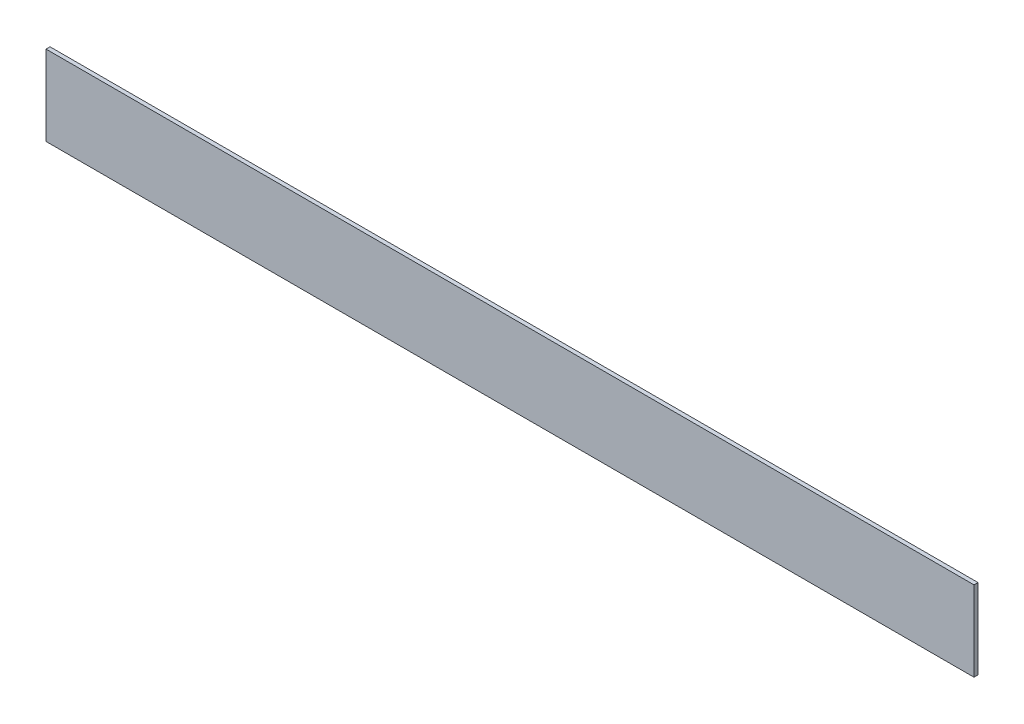
from build123d import *

# Parameters (mm, degrees)
SKETCH1_W           = 2319.43924105
SKETCH1_H           = 200
BOSS_EXTRUDE1_DEPTH = 10


with BuildPart() as part:
    # Sketch1 → Boss-Extrude1 (new body)
    with BuildSketch(Plane.XY):
        Rectangle(SKETCH1_W, SKETCH1_H)
    extrude(amount=BOSS_EXTRUDE1_DEPTH)


solid = part.part
